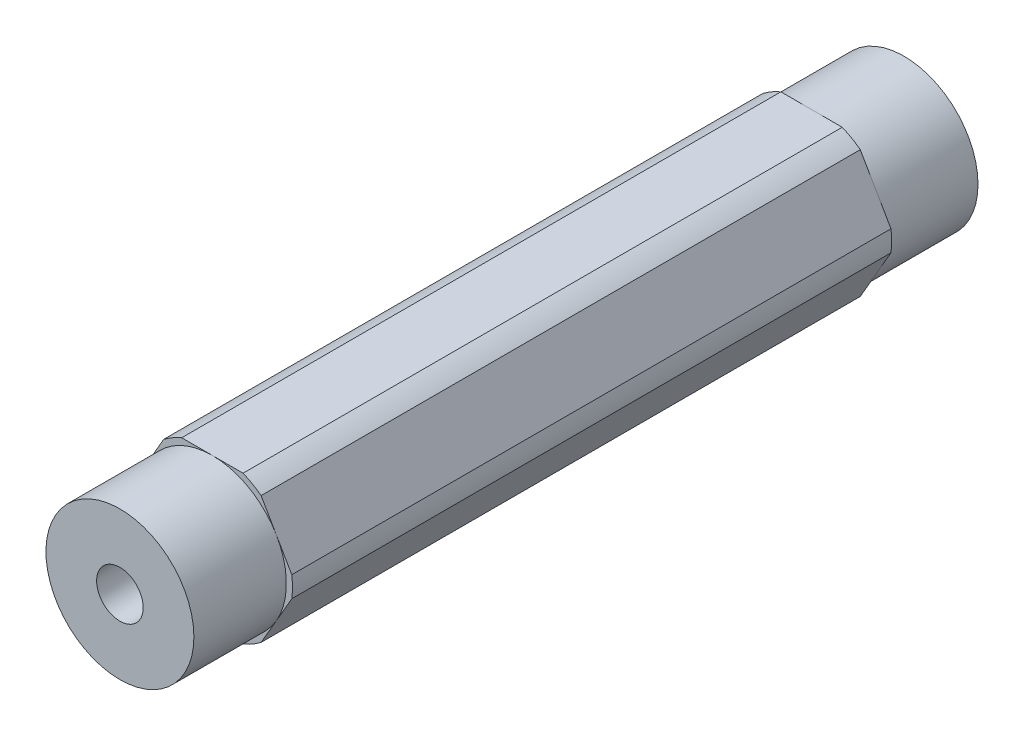
from build123d import *

# Parameters (mm, degrees)
SKETCH1_R           = 2.000000064
BOSS_EXTRUDE1_DEPTH = 25.7175
SKETCH4_R           = 6.35
SKETCH4_R_2         = 2.000000064
BOSS_EXTRUDE2_DEPTH = 7.9375


with BuildPart() as part:
    # Sketch1 → Boss-Extrude1 (new, symmetric)
    with BuildSketch(Plane.XY):
        with BuildLine():
            ThreePointArc((4.181770846, 5.456960429), (3.437499983, 5.953924622), (2.634980936, 6.35))
            Line((2.634980936, 6.35), (-2.634980936, 6.35))
            ThreePointArc((-2.634980936, 6.35), (-3.437499983, 5.953924622), (-4.181770846, 5.456960429))
            Line((-4.181770846, 5.456960429), (-6.816751782, 0.893039571))
            ThreePointArc((-6.816751782, 0.893039571), (-6.874999966, 0), (-6.816751782, -0.893039571))
            Line((-6.816751782, -0.893039571), (-4.181770846, -5.456960429))
            ThreePointArc((-4.181770846, -5.456960429), (-3.437499983, -5.953924622), (-2.634980936, -6.35))
            Line((-2.634980936, -6.35), (2.634980936, -6.35))
            ThreePointArc((2.634980936, -6.35), (3.437499983, -5.953924622), (4.181770846, -5.456960429))
            Line((4.181770846, -5.456960429), (6.816751782, -0.893039571))
            ThreePointArc((6.816751782, -0.893039571), (6.860422465, -0.447468582), (6.874999966, 0))
            ThreePointArc((6.874999966, 0), (6.860422465, 0.447468582), (6.816751782, 0.893039571))
            Line((6.816751782, 0.893039571), (4.181770846, 5.456960429))
        make_face()
        Circle(SKETCH1_R, mode=Mode.SUBTRACT)
    extrude(amount=BOSS_EXTRUDE1_DEPTH, both=True)

    # Sketch4 → Boss-Extrude2 (add)
    with BuildSketch(Plane.XY.offset(25.7175)):
        with Locations(Location((0, 0, 0), (0, 0, 150))):
            Circle(SKETCH4_R)
        Circle(SKETCH4_R_2, mode=Mode.SUBTRACT)
    boss_extrude2 = extrude(amount=BOSS_EXTRUDE2_DEPTH)

    # Mirror1: Boss-Extrude2 across plane
    add(boss_extrude2.mirror(Plane.XY))


solid = part.part
